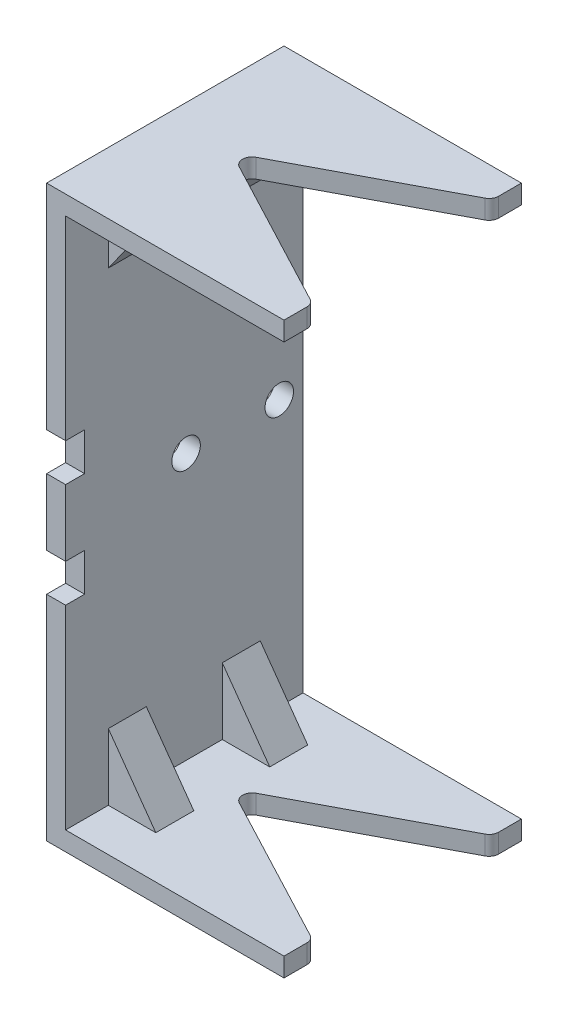
from build123d import *

# Parameters (mm, degrees)
BOSS_EXTRUDE2_DEPTH = 12.5
CUT_EXTRUDE1_DEPTH  = 67.191011474
FILLET1_R           = 1
SKETCH7_R           = 1.5
CUT_EXTRUDE2_DEPTH  = 10
BOSS_EXTRUDE8_DEPTH = 8
CUT_EXTRUDE4_DEPTH  = 4
SKETCH15_W          = 2
SKETCH15_H          = 4
CUT_EXTRUDE5_DEPTH  = 2


with BuildPart() as part:
    # Sketch1 → Boss-Extrude2 (new, symmetric)
    with BuildSketch(Plane.XY):
        Polygon((0, 0), (0, 60), (25, 60), (25, 58), (2, 58), (2, 2), (25, 2), (25, 0), align=None)
    extrude(amount=BOSS_EXTRUDE2_DEPTH, both=True)

    # Sketch6 → Cut-Extrude1 (cut, through all)
    with BuildSketch(Plane(origin=(0, 60, 0), x_dir=(1, 0, 0), z_dir=(0, 1, 0))):
        Polygon((7, 0), (25, 9.5), (25, -9.5), align=None)
    extrude(amount=-CUT_EXTRUDE1_DEPTH, mode=Mode.SUBTRACT)

    # Fillet1
    fillet1_edges = [part.edges().sort_by_distance(p)[0] for p in [
        (25, 1, 9.5),
        (25, 59, 9.5),
        (7, 1, 0),
        (7, 59, 0),
        (25, 1, -9.5),
        (25, 59, -9.5),
    ]]
    fillet(fillet1_edges, radius=FILLET1_R)

    # Sketch7 → Cut-Extrude2 (cut)
    with BuildSketch(Plane(origin=(2, 0, 0), x_dir=(0, 0, -1), z_dir=(1, 0, 0))):
        with Locations(Location((0.18959721, 30, 0), (0, 0, 90))):
            Circle(SKETCH7_R)
        with Locations(Location((10, 30, 0), (0, 0, 90))):
            Circle(SKETCH7_R)
    extrude(amount=-CUT_EXTRUDE2_DEPTH, mode=Mode.SUBTRACT)

    # Sketch13 → Boss-Extrude8 (add, symmetric)
    with BuildSketch(Plane.XY):
        Polygon((2, 58), (7, 58), (2, 51), align=None)
        Polygon((7, 2), (2, 2), (2, 9), align=None)
    extrude(amount=BOSS_EXTRUDE8_DEPTH, both=True)

    # Sketch14 → Cut-Extrude4 (cut, symmetric)
    with BuildSketch(Plane.XY):
        Polygon((2, 2), (2, 9), (7, 2), align=None)
        Polygon((2, 58), (7, 58), (2, 51), align=None)
    extrude(amount=CUT_EXTRUDE4_DEPTH, both=True, mode=Mode.SUBTRACT)

    # Sketch15 → Cut-Extrude5 (cut)
    with BuildSketch(Plane(origin=(2, 0, 0), x_dir=(0, 0, -1), z_dir=(1, 0, 0))):
        with Locations((-11.5, 35.5)):
            Rectangle(SKETCH15_W, SKETCH15_H)
        with Locations((-11.5, 24.5)):
            Rectangle(SKETCH15_W, SKETCH15_H)
    extrude(amount=-CUT_EXTRUDE5_DEPTH, mode=Mode.SUBTRACT)


solid = part.part
